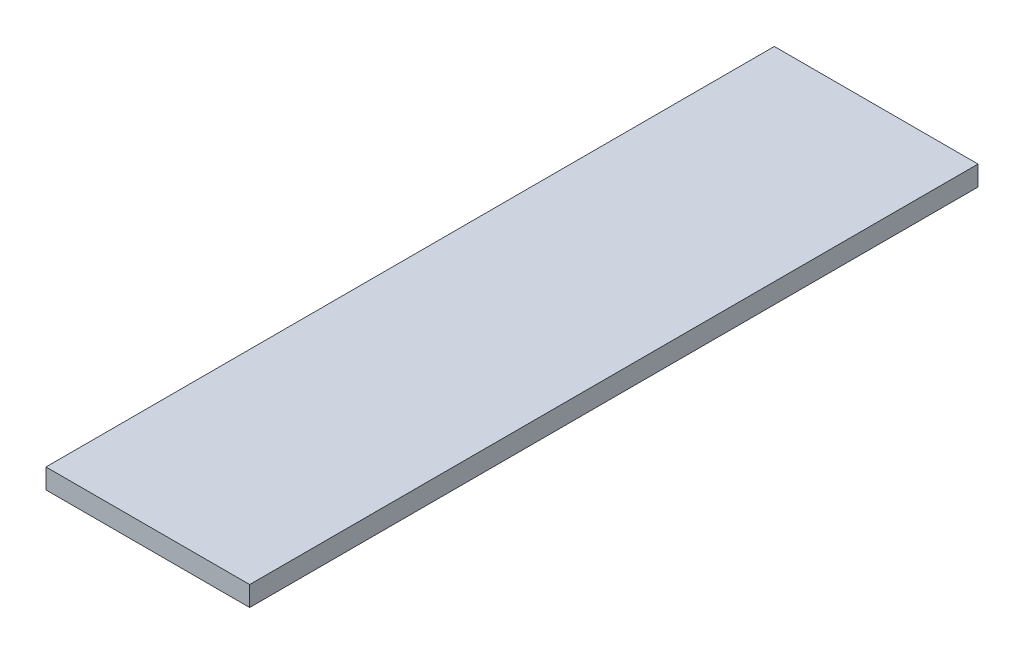
from build123d import *

# Parameters (mm, degrees)
SKETCH1_W           = 184
SKETCH1_H           = 18
BOSS_EXTRUDE1_DEPTH = 658


with BuildPart() as part:
    # Sketch1 → Boss-Extrude1 (new body)
    with BuildSketch(Plane.XY):
        with Locations((-97, -1030.94)):
            Rectangle(SKETCH1_W, SKETCH1_H)
    extrude(amount=-BOSS_EXTRUDE1_DEPTH)


solid = part.part
